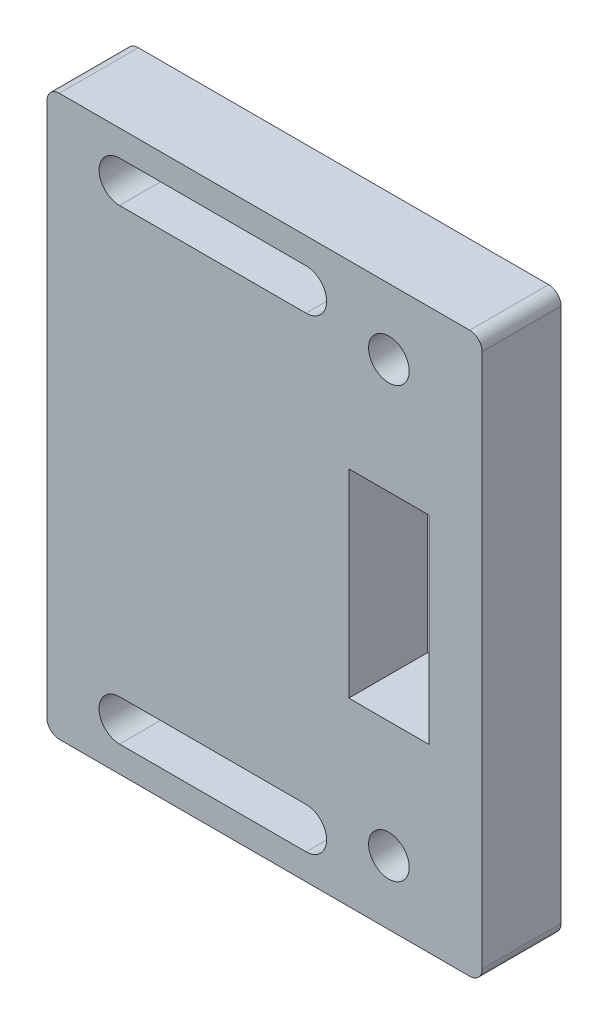
from build123d import *

# Parameters (mm, degrees)
SKETCH1_W                                        = 70
SKETCH1_H                                        = 90
BOSS_EXTRUDE1_DEPTH                              = 12.7
CSK_FOR_1_4_FLAT_HEAD_MACHINE_SCREW1_D           = 6.5278
CSK_FOR_1_4_FLAT_HEAD_MACHINE_SCREW1_CSINK_D     = 12.8778
CSK_FOR_1_4_FLAT_HEAD_MACHINE_SCREW1_CSINK_ANGLE = 82
FILLET1_R                                        = 2
CUT_EXTRUDE1_DEPTH                               = 115.72266559


with BuildPart() as part:
    # Sketch1 → Boss-Extrude1 (new body)
    with BuildSketch(Plane.XY):
        with Locations((35, -45)):
            Rectangle(SKETCH1_W, SKETCH1_H)
        Polygon((55, -29.025), (61.45, -29.025), (61.45, -60.975), (55, -60.975), (48.55, -60.975), (48.55, -29.025), align=None, mode=Mode.SUBTRACT)
    extrude(amount=BOSS_EXTRUDE1_DEPTH)

    # CSK for 1/4 Flat Head Machine Screw1 (through all)
    with Locations(Plane(origin=(0, 0, 0), x_dir=(-1, 0, 0), z_dir=(0, 0, -1))):
        with Locations((-55, -10.579610023), (-55, -79.699610023)):
            CounterSinkHole(CSK_FOR_1_4_FLAT_HEAD_MACHINE_SCREW1_D / 2, CSK_FOR_1_4_FLAT_HEAD_MACHINE_SCREW1_CSINK_D / 2, counter_sink_angle=CSK_FOR_1_4_FLAT_HEAD_MACHINE_SCREW1_CSINK_ANGLE)

    # Fillet1
    fillet1_edges = [part.edges().sort_by_distance(p)[0] for p in [
        (0, 0, 6.35),
        (70, 0, 6.35),
        (70, -90, 6.35),
        (0, -90, 6.35),
    ]]
    fillet(fillet1_edges, radius=FILLET1_R)

    # Sketch7 → Cut-Extrude1 (cut, through all)
    with BuildSketch(Plane(origin=(0, 0, 0), x_dir=(-1, 0, 0), z_dir=(0, 0, -1))):
        with BuildLine():
            Line((-41.687469931, -85.815), (-11.687469931, -85.815))
            ThreePointArc((-11.687469931, -85.815), (-8.387469931, -82.515), (-11.687469931, -79.215))
            Line((-11.687469931, -79.215), (-41.687469931, -79.215))
            ThreePointArc((-41.687469931, -79.215), (-44.987469931, -82.515), (-41.687469931, -85.815))
        make_face()
        with BuildLine():
            Line((-11.687469931, -10.785), (-41.687469931, -10.785))
            ThreePointArc((-41.687469931, -10.785), (-44.987469931, -7.485), (-41.687469931, -4.185))
            Line((-41.687469931, -4.185), (-11.687469931, -4.185))
            ThreePointArc((-11.687469931, -4.185), (-8.387469931, -7.485), (-11.687469931, -10.785))
        make_face()
    extrude(amount=-CUT_EXTRUDE1_DEPTH, mode=Mode.SUBTRACT)


solid = part.part
